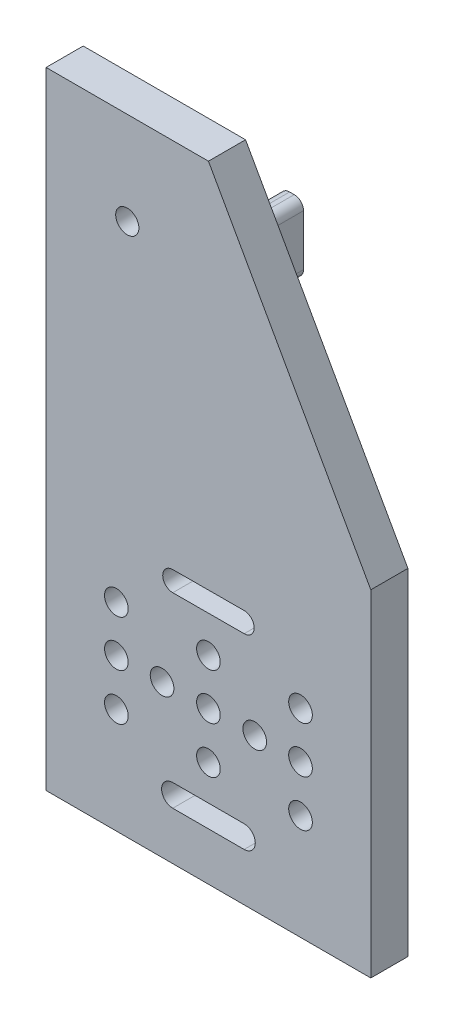
from build123d import *

# Parameters (mm, degrees)
ESQUISSE1_R             = 2.5
BOSS_EXTRU_1_DEPTH      = 8
BOSS_EXTRU_3_DEPTH      = 15
CONG_1_R                = 1
ESQUISSE5_R             = 3.75
ENL_V_MAT_EXTRU_1_DEPTH = 1.75
ESQUISSE6_R             = 2.55
ENL_V_MAT_EXTRU_2_DEPTH = 153.807067899
ENL_V_MAT_EXTRU_3_DEPTH = 153.807067899
BOSS_EXTRU_4_DEPTH      = 3
CONG_2_R                = 0.5


with BuildPart() as part:
    # Esquisse1 → Boss.-Extru.1 (new body)
    with BuildSketch(Plane.XY):
        Polygon((0, 0), (70, 0), (70, 72.472327189), (35, 135), (0, 135), align=None)
        with Locations((17.5, 115)):
            Circle(ESQUISSE1_R, mode=Mode.SUBTRACT)
    extrude(amount=BOSS_EXTRU_1_DEPTH)

    # Esquisse4 → Boss.-Extru.3 (add)
    with BuildSketch(Plane(origin=(0, 0, 0), x_dir=(-1, 0, 0), z_dir=(0, 0, -1))):
        with BuildLine():
            Line((-27.49686293, 105), (-7.50313707, 105))
            Line((-7.50313707, 105), (-7.50313707, 113))
            ThreePointArc((-7.50313707, 113), (-6.917350632, 114.414213562), (-5.50313707, 115))
            Line((-5.50313707, 115), (-4.504414059, 115))
            ThreePointArc((-4.504414059, 115), (-3.090200496, 114.414213562), (-2.504414059, 113))
            Line((-2.504414059, 113), (-2.504414059, 102.004411464))
            ThreePointArc((-2.504414059, 102.004411464), (-3.090200496, 100.590197902), (-4.504414059, 100.004411464))
            Line((-4.504414059, 100.004411464), (-30.495585941, 100.004411464))
            ThreePointArc((-30.495585941, 100.004411464), (-31.909799504, 100.590197902), (-32.495585941, 102.004411464))
            Line((-32.495585941, 102.004411464), (-32.495585941, 113))
            ThreePointArc((-32.495585941, 113), (-31.909799504, 114.414213562), (-30.495585941, 115))
            Line((-30.495585941, 115), (-29.49686293, 115))
            ThreePointArc((-29.49686293, 115), (-28.082649368, 114.414213562), (-27.49686293, 113))
            Line((-27.49686293, 113), (-27.49686293, 105))
        make_face()
    extrude(amount=BOSS_EXTRU_3_DEPTH)

    # Congé1
    cong_1_edges = [part.edges().sort_by_distance(p)[0] for p in [
        (27.49686293, 109, 0),
        (28.082649368, 114.414213562, 0),
        (29.996224436, 115, 0),
        (31.909799504, 114.414213562, 0),
        (32.495585941, 107.502205732, 0),
        (31.909799504, 100.590197902, 0),
        (17.5, 100.004411464, 0),
        (7.50313707, 109, 0),
        (6.917350632, 114.414213562, 0),
        (5.003775564, 115, 0),
        (3.090200496, 114.414213562, 0),
        (2.504414059, 107.502205732, 0),
        (3.090200496, 100.590197902, 0),
    ]]
    fillet(cong_1_edges, radius=CONG_1_R)

    # Esquisse5 → Enlèv. mat.-Extru.1 (cut)
    with BuildSketch(Plane(origin=(0, 0, 0), x_dir=(-1, 0, 0), z_dir=(0, 0, -1))):
        with Locations((-54.85, 52.748281044)):
            Circle(ESQUISSE5_R)
        with Locations((-15.15, 52.748281044)):
            Circle(ESQUISSE5_R)
        with Locations((-54.85, 12.75)):
            Circle(ESQUISSE5_R)
        with Locations((-15.15, 12.75)):
            Circle(ESQUISSE5_R)
    extrude(amount=-ENL_V_MAT_EXTRU_1_DEPTH, mode=Mode.SUBTRACT)

    # Esquisse6 → Enlèv. mat.-Extru.2 (cut, through all)
    with BuildSketch(Plane(origin=(0, 0, 0), x_dir=(-1, 0, 0), z_dir=(0, 0, -1))):
        with Locations((-54.846908299, 42.752516513)):
            Circle(ESQUISSE6_R)
        with Locations((-34.997746817, 42.752516513)):
            Circle(ESQUISSE6_R)
        with Locations((-54.846908299, 32.788691402)):
            Circle(ESQUISSE6_R)
        with Locations((-44.984599054, 32.788691402)):
            Circle(ESQUISSE6_R)
        with Locations((-34.997746817, 32.788691402)):
            Circle(ESQUISSE6_R)
        with Locations((-25.000410905, 32.788691402)):
            Circle(ESQUISSE6_R)
        with Locations((-15.150407315, 42.752516513)):
            Circle(ESQUISSE6_R)
        with Locations((-15.15, 32.788691402)):
            Circle(ESQUISSE6_R)
        with Locations((-15.15, 22.746834884)):
            Circle(ESQUISSE6_R)
        with Locations((-34.997746817, 22.746834884)):
            Circle(ESQUISSE6_R)
        with Locations((-54.846908299, 22.746834884)):
            Circle(ESQUISSE6_R)
    extrude(amount=-ENL_V_MAT_EXTRU_2_DEPTH, mode=Mode.SUBTRACT)

    # Esquisse7 → Enlèv. mat.-Extru.3 (cut, through all)
    with BuildSketch(Plane(origin=(0, 0, 0), x_dir=(-1, 0, 0), z_dir=(0, 0, -1))):
        with BuildLine():
            Line((-42.688697109, 54.953454119), (-27.29882218, 54.909006883))
            ThreePointArc((-27.29882218, 54.909006883), (-25.144336695, 52.742040688), (-27.311302891, 50.587555204))
            Line((-27.311302891, 50.587555204), (-42.70117782, 50.63200244))
            ThreePointArc((-42.70117782, 50.63200244), (-44.855663305, 52.798968635), (-42.688697109, 54.953454119))
        make_face()
        with BuildLine():
            Line((-42.694937465, 15.15279537), (-27.305062535, 15.15279537))
            ThreePointArc((-27.305062535, 15.15279537), (-24.902267165, 12.75), (-27.305062535, 10.34720463))
            Line((-27.305062535, 10.34720463), (-42.694937465, 10.34720463))
            ThreePointArc((-42.694937465, 10.34720463), (-45.097732835, 12.75), (-42.694937465, 15.15279537))
        make_face()
    extrude(amount=-ENL_V_MAT_EXTRU_3_DEPTH, mode=Mode.SUBTRACT)

    # Esquisse8 → Boss.-Extru.4 (add)
    with BuildSketch(Plane(origin=(0, 0, 0), x_dir=(-1, 0, 0), z_dir=(0, 0, -1))):
        with BuildLine():
            Line((-58.096218294, 61.887268694), (-51.603781706, 61.887268694))
            ThreePointArc((-51.603781706, 61.887268694), (-50.166286551, 60.449773539), (-51.603781706, 59.012278383))
            Line((-51.603781706, 59.012278383), (-58.096218294, 59.012278383))
            ThreePointArc((-58.096218294, 59.012278383), (-59.533713449, 60.449773539), (-58.096218294, 61.887268694))
        make_face()
        with BuildLine():
            Line((-11.903781706, 61.887268694), (-18.396218294, 61.887268694))
            ThreePointArc((-18.396218294, 61.887268694), (-19.833713449, 60.449773539), (-18.396218294, 59.012278383))
            Line((-18.396218294, 59.012278383), (-11.903781706, 59.012278383))
            ThreePointArc((-11.903781706, 59.012278383), (-10.466286551, 60.449773539), (-11.903781706, 61.887268694))
        make_face()
        with BuildLine():
            Line((-58.096218294, 3.690114109), (-51.603781706, 3.690114109))
            ThreePointArc((-51.603781706, 3.690114109), (-50.166286551, 5.127609265), (-51.603781706, 6.56510442))
            Line((-51.603781706, 6.56510442), (-58.096218294, 6.56510442))
            ThreePointArc((-58.096218294, 6.56510442), (-59.533713449, 5.127609265), (-58.096218294, 3.690114109))
        make_face()
        with BuildLine():
            Line((-11.903781706, 3.690114109), (-18.396218294, 3.690114109))
            ThreePointArc((-18.396218294, 3.690114109), (-19.833713449, 5.127609265), (-18.396218294, 6.56510442))
            Line((-18.396218294, 6.56510442), (-11.903781706, 6.56510442))
            ThreePointArc((-11.903781706, 6.56510442), (-10.466286551, 5.127609265), (-11.903781706, 3.690114109))
        make_face()
    extrude(amount=BOSS_EXTRU_4_DEPTH)

    # Congé2
    cong_2_edges = [part.edges().sort_by_distance(p)[0] for p in [
        (19.833713449, 5.127609265, -3),
        (15.15, 6.56510442, -3),
        (59.533713449, 5.127609265, -3),
        (54.85, 6.56510442, -3),
        (19.833713449, 60.449773539, -3),
        (15.15, 61.887268694, -3),
        (59.533713449, 60.449773539, -3),
        (54.85, 61.887268694, -3),
        (15.15, 3.690114109, -3),
        (10.466286551, 5.127609265, -3),
        (54.85, 3.690114109, -3),
        (50.166286551, 5.127609265, -3),
        (15.15, 59.012278383, -3),
        (10.466286551, 60.449773539, -3),
        (54.85, 59.012278383, -3),
        (50.166286551, 60.449773539, -3),
    ]]
    fillet(cong_2_edges, radius=CONG_2_R)


solid = part.part
